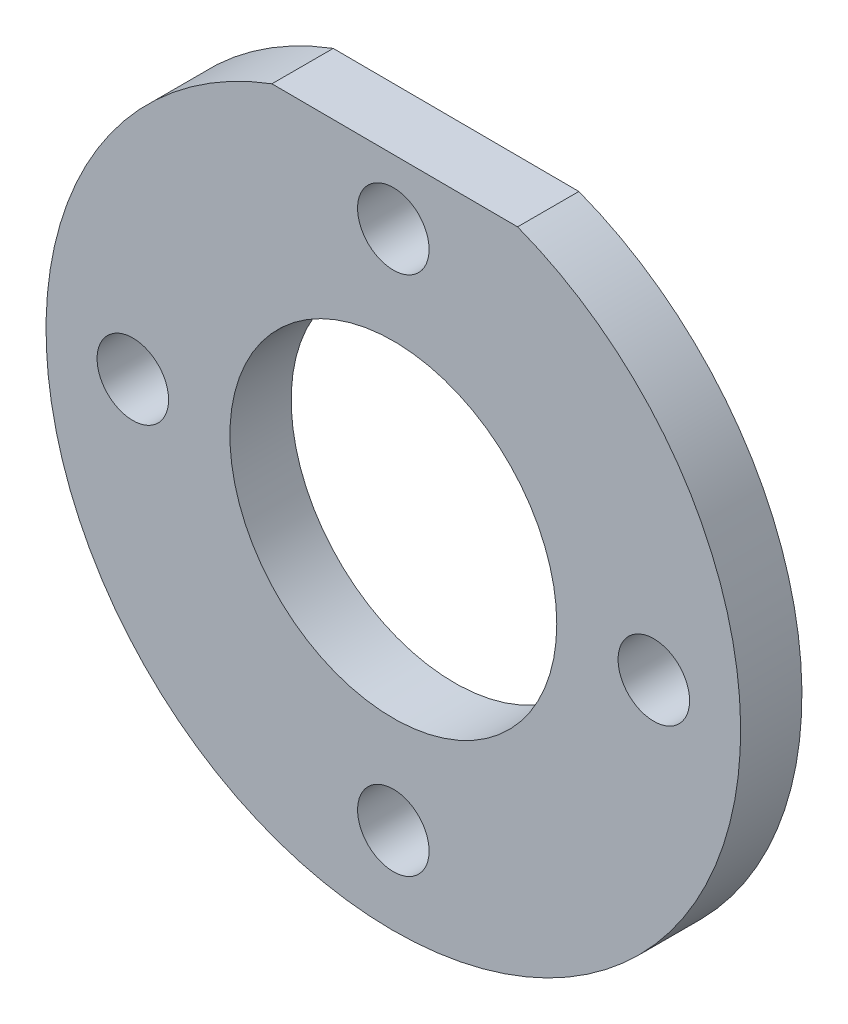
from build123d import *

# Parameters (mm, degrees)
ESBO_O1_R                = 34
ESBO_O1_R_2              = 16
ESBO_O1_R_3              = 3.5
RESSALTO_EXTRUS_O1_DEPTH = 6
CORTE_EXTRUS_O1_START    = -10
CORTE_EXTRUS_O1_DEPTH    = 10


with BuildPart() as part:
    # Esboço1 → Ressalto-extrusão1 (new body)
    with BuildSketch(Plane.XY):
        Circle(ESBO_O1_R)
        Circle(ESBO_O1_R_2, mode=Mode.SUBTRACT)
        with Locations((0, 25.5)):
            Circle(ESBO_O1_R_3, mode=Mode.SUBTRACT)
        with Locations((25.5, 0)):
            Circle(ESBO_O1_R_3, mode=Mode.SUBTRACT)
        with Locations((0, -25.5)):
            Circle(ESBO_O1_R_3, mode=Mode.SUBTRACT)
        with Locations((-25.5, 0)):
            Circle(ESBO_O1_R_3, mode=Mode.SUBTRACT)
    extrude(amount=RESSALTO_EXTRUS_O1_DEPTH)

    # Esboço2 → Corte-extrusão1 (cut)
    with BuildSketch(Plane.XY.offset(6).offset(CORTE_EXTRUS_O1_START)):
        with BuildLine():
            Line((-11.884080362, 31.855433351), (12.162956055, 31.75))
            ThreePointArc((12.162956055, 31.75), (0.149070322, 33.999673205), (-11.884080362, 31.855433351))
        make_face()
    extrude(amount=CORTE_EXTRUS_O1_DEPTH, mode=Mode.SUBTRACT)


solid = part.part
